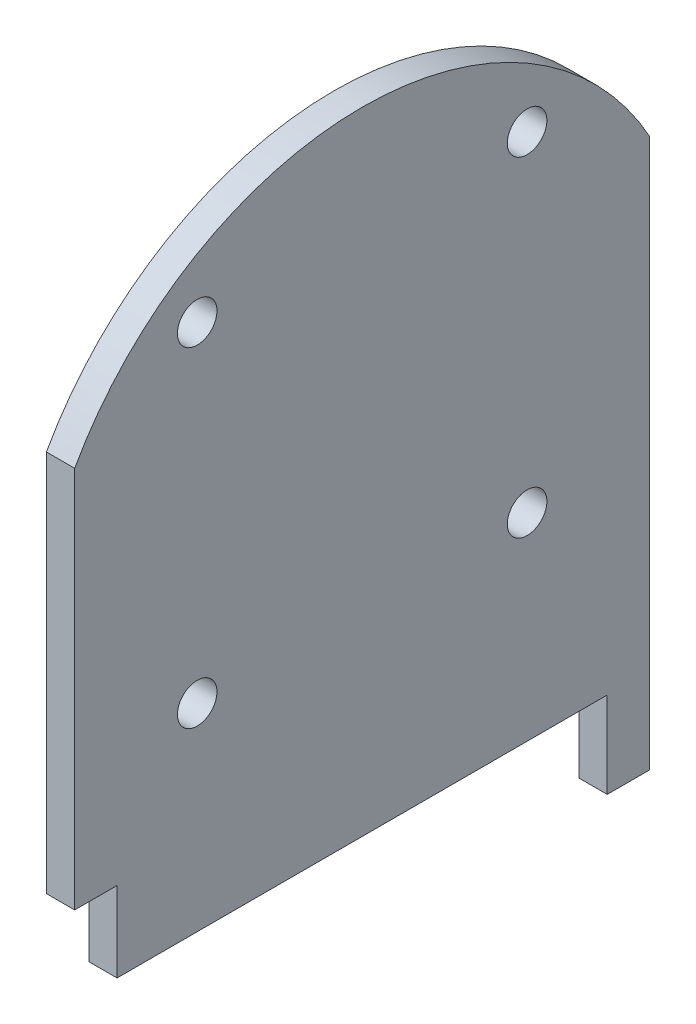
from build123d import *

# Parameters (mm, degrees)
SKETCH_2_R      = 2.1
EXTRUDE_1_DEPTH = 3


with BuildPart() as part:
    # 草图2 → 凸台-拉伸1 (new body)
    with BuildSketch(Plane.ZY.offset(116.606649797)):
        with BuildLine():
            Line((1030.654259328, -102.283530386), (1082.654259328, -102.283530386))
            Line((1082.654259328, -102.283530386), (1082.654259328, -93.783530386))
            Line((1082.654259328, -93.783530386), (1087.154259328, -93.783530386))
            Line((1087.154259328, -93.783530386), (1087.154259328, -63.783530386))
            Line((1087.154259328, -63.783530386), (1087.154259328, -53.200711014))
            ThreePointArc((1087.154259328, -53.200711014), (1056.654259328, -35.273255635), (1026.154259328, -53.200711014))
            Line((1026.154259328, -53.200711014), (1026.154259328, -63.783530386))
            Line((1026.154259328, -63.783530386), (1026.154259328, -111.416059373))
            Line((1026.154259328, -111.416059373), (1030.654259328, -111.416059373))
            Line((1030.654259328, -111.416059373), (1030.654259328, -102.283530386))
        make_face()
        with Locations(Location((1074.154259328, -81.283530386, 0), (0, 0, 270))):
            Circle(SKETCH_2_R, mode=Mode.SUBTRACT)
        with Locations(Location((1039.154259328, -81.283530386, 0), (0, 0, 270))):
            Circle(SKETCH_2_R, mode=Mode.SUBTRACT)
        with Locations(Location((1074.154259328, -46.283530386, 0), (0, 0, 270))):
            Circle(SKETCH_2_R, mode=Mode.SUBTRACT)
        with Locations(Location((1039.154259328, -46.283530386, 0), (0, 0, 270))):
            Circle(SKETCH_2_R, mode=Mode.SUBTRACT)
    extrude(amount=EXTRUDE_1_DEPTH)


solid = part.part
